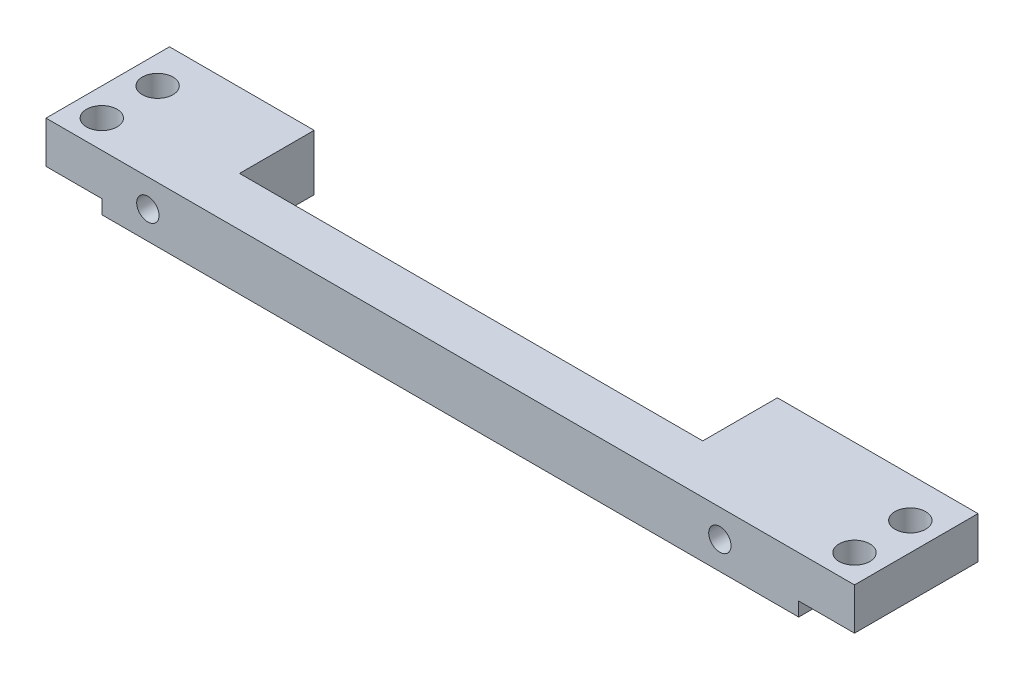
from build123d import *

# Parameters (mm, degrees)
MAIN_STOCK_START                         = 2.248090434
SKETCH_1_W                               = 57.95
SKETCH_1_H                               = 4
MAIN_STOCK_DEPTH                         = 8.851909566
SKETCH_2_W                               = 4
SKETCH_2_H                               = 1
CORNER_LEFT_RECTANGULAR_NOTCH_4X1_DEPTH  = 8.851909566
SKETCH_3_W                               = 4
SKETCH_3_H                               = 1
CORNER_RIGHT_RECTANGULAR_NOTCH_4X1_DEPTH = 8.851909566
SKETCH_4_R                               = 0.8
FRAME_2XD1P6_THROUGH_DEPTH               = 72.016485431
SKETCH_5_W                               = 33.203
SKETCH_5_H                               = 6.7
MERGED_INTERFACE_WINDOW_33P203X6P7_DEPTH = 4
SKETCH_6_R                               = 1.1
CORNER_REAR_4XD2P2_THROUGH_DEPTH         = 55.932071689


with BuildPart() as part:
    # 草图1 → Main_Stock (new body)
    with BuildSketch(Plane.XY.offset(MAIN_STOCK_START)):
        with Locations((24.675, 43.68)):
            Rectangle(SKETCH_1_W, SKETCH_1_H)
    extrude(amount=MAIN_STOCK_DEPTH)

    # 草图2 → Corner_Left_Rectangular_Notch_4x1 (cut)
    with BuildSketch(Plane.XY.offset(11.1)):
        with Locations((-2.3, 42.18)):
            Rectangle(SKETCH_2_W, SKETCH_2_H)
    extrude(amount=-CORNER_LEFT_RECTANGULAR_NOTCH_4X1_DEPTH, mode=Mode.SUBTRACT)

    # 草图3 → Corner_Right_Rectangular_Notch_4x1 (cut)
    with BuildSketch(Plane.XY.offset(11.1)):
        with Locations((51.65, 42.18)):
            Rectangle(SKETCH_3_W, SKETCH_3_H)
    extrude(amount=-CORNER_RIGHT_RECTANGULAR_NOTCH_4X1_DEPTH, mode=Mode.SUBTRACT)

    # 草图4 → Frame_2xD1p6_Through (cut, through all)
    with BuildSketch(Plane.XY.offset(11.1)):
        with Locations((3, 43.68)):
            Circle(SKETCH_4_R)
        with Locations((44, 43.68)):
            Circle(SKETCH_4_R)
    extrude(amount=-FRAME_2XD1P6_THROUGH_DEPTH, mode=Mode.SUBTRACT)

    # 草图5 → Merged_Interface_Window_33p203x6p7 (cut)
    with BuildSketch(Plane(origin=(0, 45.68, 0), x_dir=(1, 0, 0), z_dir=(0, 1, 0))):
        with Locations((22.6715, -4.25)):
            Rectangle(SKETCH_5_W, SKETCH_5_H)
    extrude(amount=-MERGED_INTERFACE_WINDOW_33P203X6P7_DEPTH, mode=Mode.SUBTRACT)

    # 草图6 → Corner_Rear_4xD2p2_Through (cut, through all)
    with BuildSketch(Plane(origin=(0, 45.68, 0), x_dir=(1, 0, 0), z_dir=(0, 1, 0))):
        with Locations(Location((-2.3, -5.1, 0), (0, 0, 270))):
            Circle(SKETCH_6_R)
        with Locations(Location((-2.3, -9.1, 0), (0, 0, 270))):
            Circle(SKETCH_6_R)
        with Locations(Location((51.65, -5.1, 0), (0, 0, 270))):
            Circle(SKETCH_6_R)
        with Locations(Location((51.65, -9.1, 0), (0, 0, 270))):
            Circle(SKETCH_6_R)
    extrude(amount=-CORNER_REAR_4XD2P2_THROUGH_DEPTH, mode=Mode.SUBTRACT)


solid = part.part
